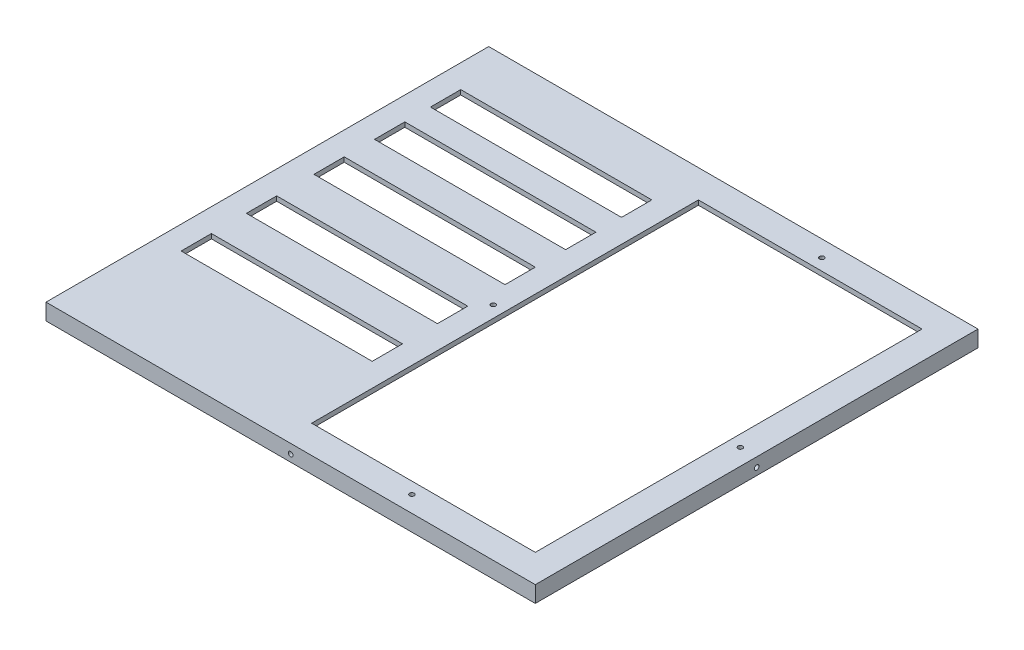
from build123d import *

# Parameters (mm, degrees)
SKETCH1_W           = 210
SKETCH1_H           = 190
SKETCH1_W_2         = 206
SKETCH1_H_2         = 186
BOSS_EXTRUDE1_DEPTH = 5
SKETCH7_R           = 1
CUT_EXTRUDE1_DEPTH  = 2
SKETCH8_R           = 1
CUT_EXTRUDE2_DEPTH  = 2
CUT_EXTRUDE3_START  = -2
SKETCH6_R           = 1
CUT_EXTRUDE3_DEPTH  = 2
CUT_EXTRUDE4_START  = -2
SKETCH5_R           = 1
CUT_EXTRUDE4_DEPTH  = 2
SKETCH9_W           = 210
SKETCH9_H           = 190
SKETCH9_R           = 1
SKETCH9_W_2         = 96
SKETCH9_H_2         = 166
SKETCH9_W_3         = 82
SKETCH9_H_3         = 13
BOSS_EXTRUDE3_DEPTH = 2


with BuildPart() as part:
    # Sketch1 → Boss-Extrude1 (new body)
    with BuildSketch(Plane(origin=(0, 0, 0), x_dir=(1, 0, 0), z_dir=(0, 1, 0))):
        Rectangle(SKETCH1_W, SKETCH1_H)
        Rectangle(SKETCH1_W_2, SKETCH1_H_2, mode=Mode.SUBTRACT)
    extrude(amount=BOSS_EXTRUDE1_DEPTH)

    # Sketch7 → Cut-Extrude1 (cut)
    with BuildSketch(Plane(origin=(105, 0, 0), x_dir=(0, 0, -1), z_dir=(1, 0, 0))):
        with Locations((0, 3)):
            Circle(SKETCH7_R)
    extrude(amount=-CUT_EXTRUDE1_DEPTH, mode=Mode.SUBTRACT)

    # Sketch8 → Cut-Extrude2 (cut)
    with BuildSketch(Plane.XY.offset(95)):
        with Locations((0, 3)):
            Circle(SKETCH8_R)
    extrude(amount=-CUT_EXTRUDE2_DEPTH, mode=Mode.SUBTRACT)

    # Sketch6 → Cut-Extrude3 (cut)
    with BuildSketch(Plane(origin=(0, 0, -95), x_dir=(-1, 0, 0), z_dir=(0, 0, -1)).offset(CUT_EXTRUDE3_START)):
        with Locations(Location((0, 3, 0), (0, 0, 180))):
            Circle(SKETCH6_R)
    extrude(amount=CUT_EXTRUDE3_DEPTH, mode=Mode.SUBTRACT)

    # Sketch5 → Cut-Extrude4 (cut)
    with BuildSketch(Plane.ZY.offset(105).offset(CUT_EXTRUDE4_START)):
        with Locations(Location((0, 3, 0), (0, 0, 180))):
            Circle(SKETCH5_R)
    extrude(amount=CUT_EXTRUDE4_DEPTH, mode=Mode.SUBTRACT)

    # Sketch9 → Boss-Extrude3 (add)
    with BuildSketch(Plane(origin=(0, 5, 0), x_dir=(1, 0, 0), z_dir=(0, 1, 0))):
        Rectangle(SKETCH9_W, SKETCH9_H)
        with Locations(Location((98, 0, 0), (0, 0, 270))):
            Circle(SKETCH9_R, mode=Mode.SUBTRACT)
        with Locations(Location((45, 88, 0), (0, 0, 270))):
            Circle(SKETCH9_R, mode=Mode.SUBTRACT)
        with Locations(Location((-8, 0, 0), (0, 0, 270))):
            Circle(SKETCH9_R, mode=Mode.SUBTRACT)
        with Locations(Location((45, -88, 0), (0, 0, 270))):
            Circle(SKETCH9_R, mode=Mode.SUBTRACT)
        with Locations((45, 0)):
            Rectangle(SKETCH9_W_2, SKETCH9_H_2, mode=Mode.SUBTRACT)
        with Locations((-54, -40.5)):
            Rectangle(SKETCH9_W_3, SKETCH9_H_3, mode=Mode.SUBTRACT)
        with Locations((-54, -12.5)):
            Rectangle(SKETCH9_W_3, SKETCH9_H_3, mode=Mode.SUBTRACT)
        with Locations((-54, 16.5)):
            Rectangle(SKETCH9_W_3, SKETCH9_H_3, mode=Mode.SUBTRACT)
        with Locations((-54, 42.5)):
            Rectangle(SKETCH9_W_3, SKETCH9_H_3, mode=Mode.SUBTRACT)
        with Locations((-54, 66.5)):
            Rectangle(SKETCH9_W_3, SKETCH9_H_3, mode=Mode.SUBTRACT)
    extrude(amount=BOSS_EXTRUDE3_DEPTH)


solid = part.part
